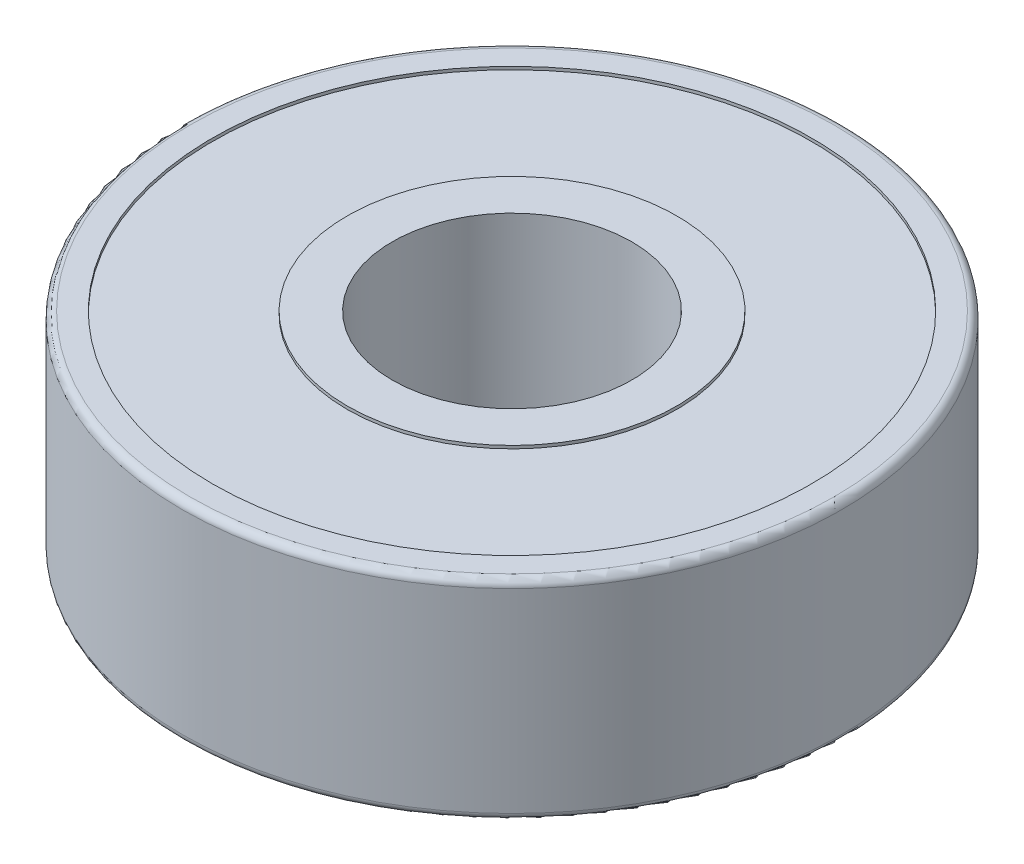
from build123d import *

# Parameters (mm, degrees)
SKETCH1_R           = 11
SKETCH1_R_2         = 4
BOSS_EXTRUDE1_DEPTH = 7
SKETCH2_R           = 10
SKETCH2_R_2         = 5.5
CUT_EXTRUDE1_DEPTH  = 0.1
FILLET1_R           = 0.25


with BuildPart() as part:
    # Sketch1 → Boss-Extrude1 (new body)
    with BuildSketch(Plane(origin=(0, 0, 0), x_dir=(1, 0, 0), z_dir=(0, 1, 0))):
        with Locations(Location((0, 0, 0), (0, 0, 270))):
            Circle(SKETCH1_R)
        with Locations(Location((0, 0, 0), (0, 0, 270))):
            Circle(SKETCH1_R_2, mode=Mode.SUBTRACT)
    extrude(amount=BOSS_EXTRUDE1_DEPTH)

    # Sketch2 → Cut-Extrude1 (cut)
    with BuildSketch(Plane(origin=(0, 7, 0), x_dir=(1, 0, 0), z_dir=(0, 1, 0))):
        with Locations(Location((0, 0, 0), (0, 0, 270))):
            Circle(SKETCH2_R)
        with Locations(Location((0, 0, 0), (0, 0, 270))):
            Circle(SKETCH2_R_2, mode=Mode.SUBTRACT)
    cut_extrude1 = extrude(amount=-CUT_EXTRUDE1_DEPTH, mode=Mode.SUBTRACT)

    # Mirror1: Cut-Extrude1 across plane
    add(cut_extrude1.mirror(Plane.ZX.offset(3.5)), mode=Mode.SUBTRACT)

    # Fillet1
    fillet1_edges = [part.edges().sort_by_distance(p)[0] for p in [
        (0, 0, -11),
        (0, 7, -11),
    ]]
    fillet(fillet1_edges, radius=FILLET1_R)


solid = part.part
